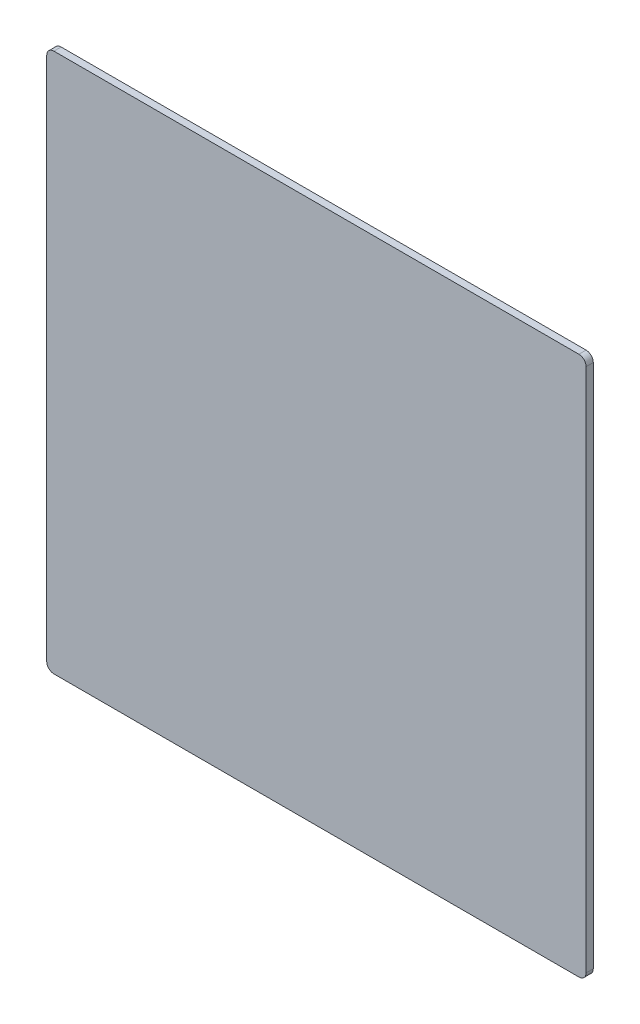
from build123d import *

# Parameters (mm, degrees)
BOSS_EXTRUDE1_DEPTH = 2


with BuildPart() as part:
    # Sketch1 → Boss-Extrude1 (new body)
    with BuildSketch(Plane.XY):
        with BuildLine():
            Line((-73, 75), (73, 75))
            ThreePointArc((73, 75), (74.414213562, 74.414213562), (75, 73))
            Line((75, 73), (75, -73))
            ThreePointArc((75, -73), (74.414213562, -74.414213562), (73, -75))
            Line((73, -75), (-73, -75))
            ThreePointArc((-73, -75), (-74.414213562, -74.414213562), (-75, -73))
            Line((-75, -73), (-75, 73))
            ThreePointArc((-75, 73), (-74.414213562, 74.414213562), (-73, 75))
        make_face()
    extrude(amount=BOSS_EXTRUDE1_DEPTH)


solid = part.part
